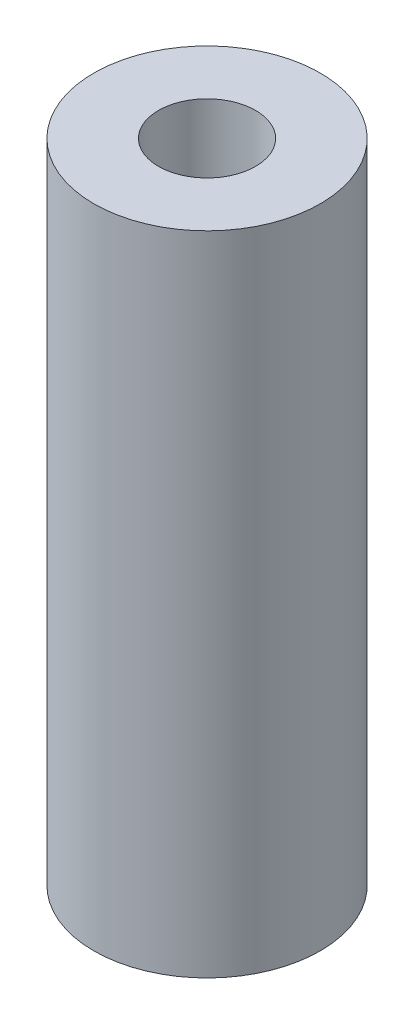
from build123d import *

# Parameters (mm, degrees)
SKETCH_1_R      = 3.5
SKETCH_1_R_2    = 1.5
EXTRUDE_2_DEPTH = 20


with BuildPart() as part:
    # 草图1 → 凸台-拉伸2 (new body)
    with BuildSketch(Plane(origin=(0, 0, 0), x_dir=(1, 0, 0), z_dir=(0, 1, 0))):
        with Locations(Location((0, 0, 0), (0, 0, 270))):
            Circle(SKETCH_1_R)
        with Locations(Location((0, 0, 0), (0, 0, 270))):
            Circle(SKETCH_1_R_2, mode=Mode.SUBTRACT)
    extrude(amount=EXTRUDE_2_DEPTH)


solid = part.part
